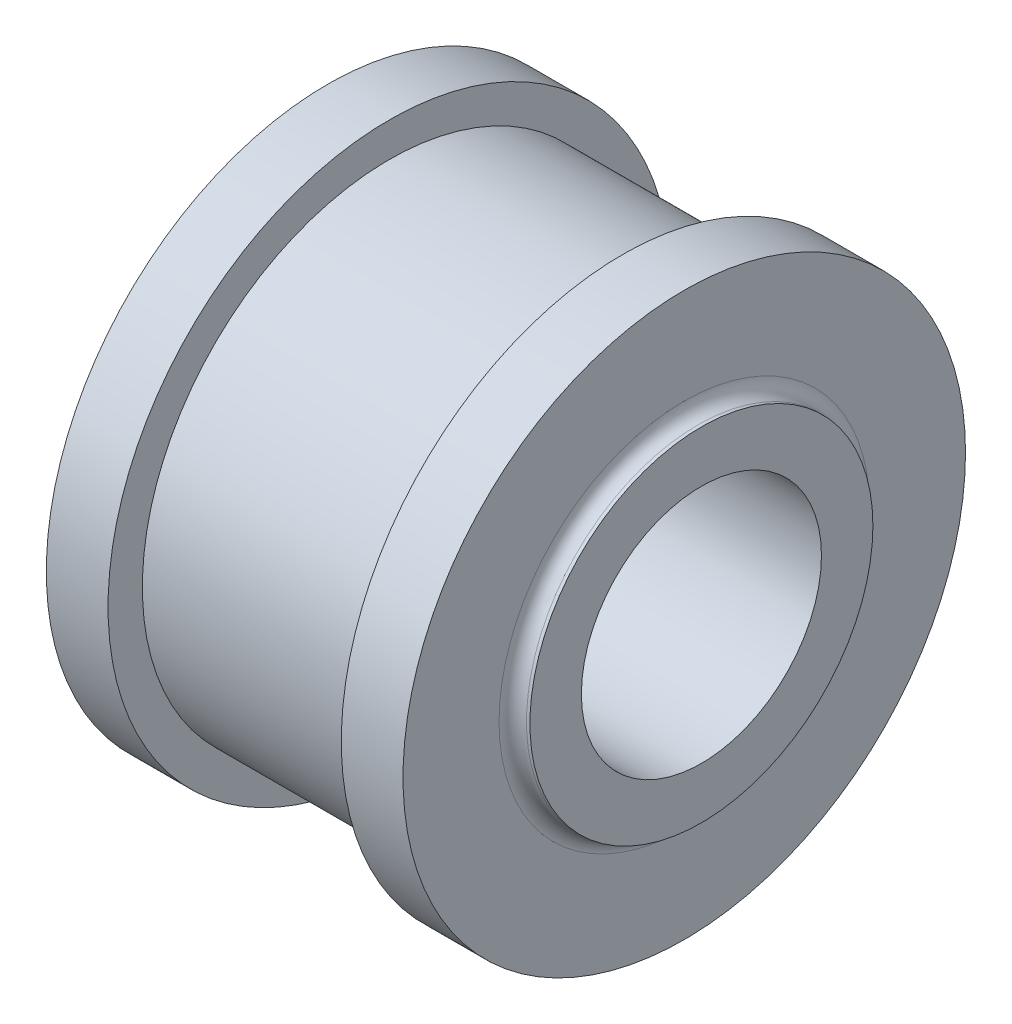
from build123d import *

# Parameters (mm, degrees)
FILLET1_R = 2


with BuildPart() as part:
    # Sketch1 → Revolve1 (revolve)
    with BuildSketch(Plane.XY, mode=Mode.PRIVATE) as revolve1_sk:
        Polygon((28.229021504, -16.110191686), (28.229021504, -8.610191686), (25.729021504, -8.610191686), (25.729021504, 7.389808314), (16.729021504, 7.389808314), (16.729021504, 2.389808314), (-17.270978496, 2.389808314), (-17.270978496, 7.389808314), (-26.270978496, 7.389808314), (-26.270978496, -8.610191686), (-28.770978496, -8.610191686), (-28.770978496, -16.110191686), align=None)
    revolve(revolve1_sk.sketch.rotate(Axis((27.520922354, -33.610191686, 0), (-1, 0, 0)), 90), axis=Axis((27.520922354, -33.610191686, 0), (-1, 0, 0)))

    # Fillet1
    fillet1_edges = [part.edges().sort_by_distance(p)[0] for p in [
        (-26.270978496, -33.610191686, 25),
        (25.729021504, -33.610191686, 25),
    ]]
    fillet(fillet1_edges, radius=FILLET1_R)


solid = part.part
